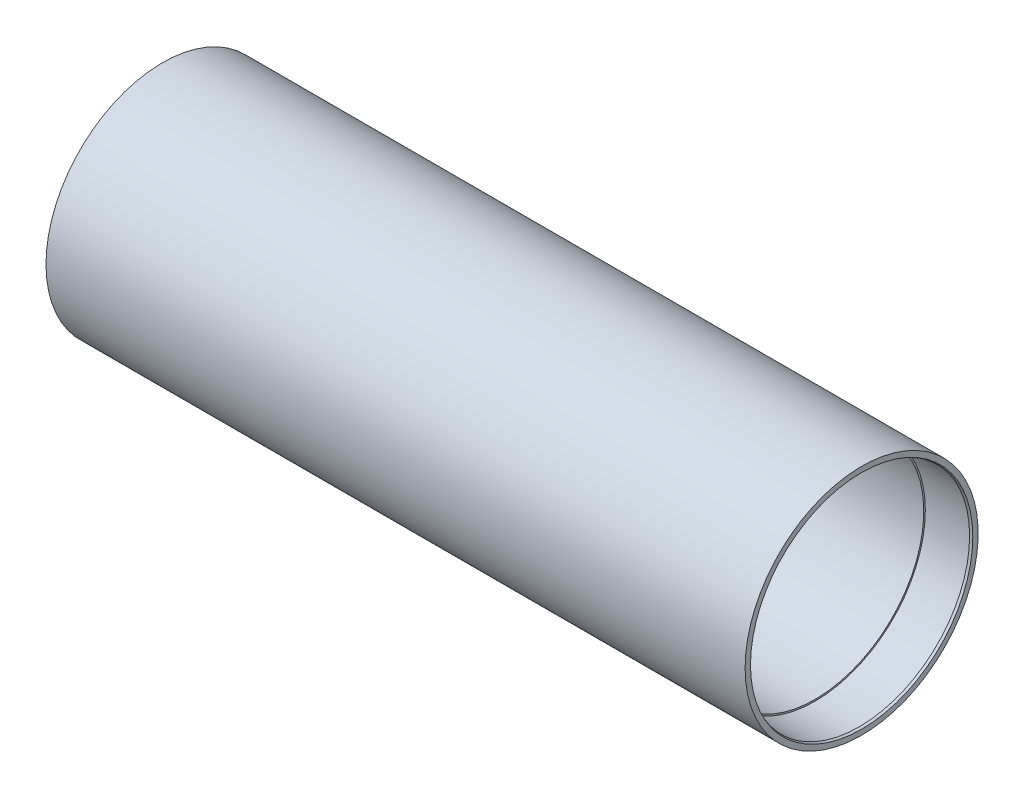
from build123d import *

# Parameters (mm, degrees)
SKETCH_1_W = 450
SKETCH_1_H = 5


with BuildPart() as part:
    # ｽｹｯﾁ1 → Revolve 585 (revolve)
    with BuildSketch(Plane.XY, mode=Mode.PRIVATE) as revolve_585_sk:
        with Locations((0, 72.5)):
            Rectangle(SKETCH_1_W, SKETCH_1_H)
    revolve(revolve_585_sk.sketch.rotate(Axis((0, 0, 0), (1, 0, 0)), 90), axis=Axis((0, 0, 0), (1, 0, 0)))

    # ｽｹｯﾁ2 → Cut-Revolve 639 (revolve, cut)
    with BuildSketch(Plane.XY, mode=Mode.PRIVATE) as cut_revolve_639_sk:
        Polygon((195, 70), (195, 71), (223.5, 71), (225, 71.55), (225, 70), align=None)
    cut_revolve_639 = revolve(cut_revolve_639_sk.sketch.rotate(Axis((0, 0, 0), (1, 0, 0)), 90), axis=Axis((0, 0, 0), (1, 0, 0)), mode=Mode.SUBTRACT)

    # Mirror 681: Cut-Revolve 639 across plane
    add(cut_revolve_639.mirror(Plane(origin=(0, 0, 0), x_dir=(0, 0, 1), z_dir=(1, 0, 0))), mode=Mode.SUBTRACT)


solid = part.part
